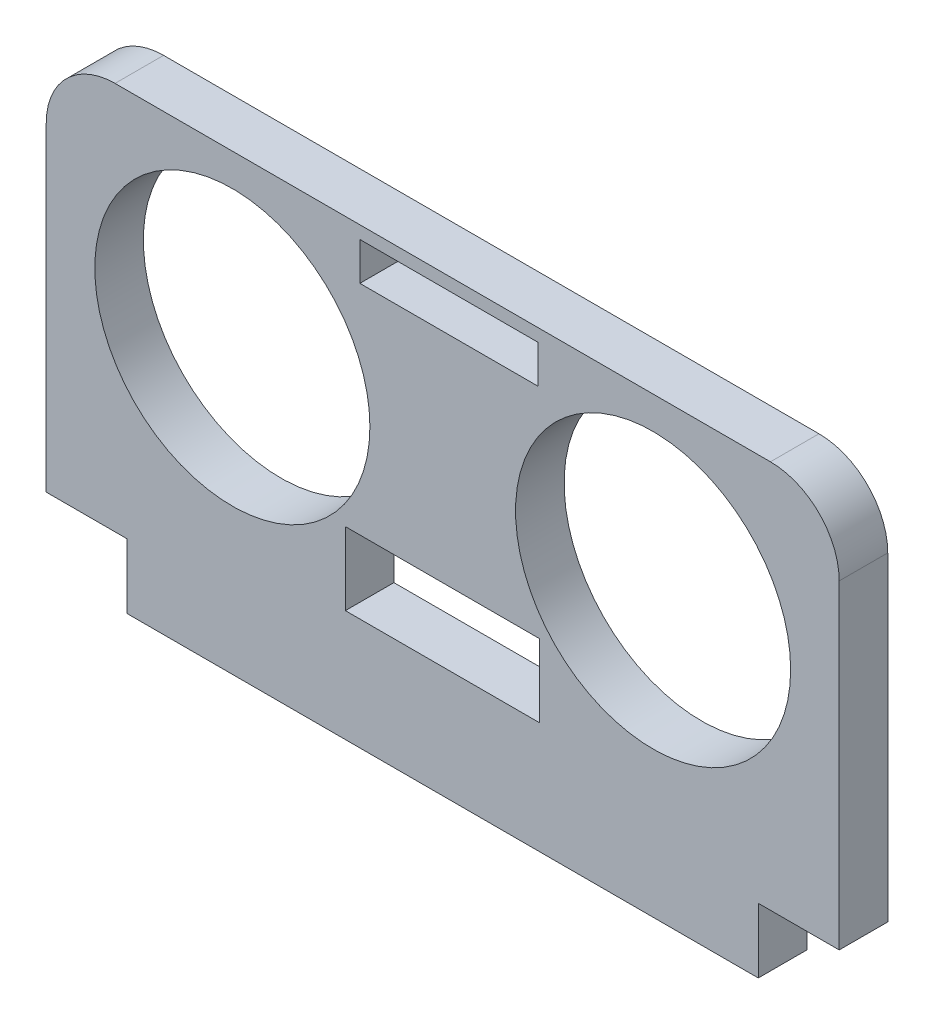
from build123d import *

# Parameters (mm, degrees)
SKETCH1_R           = 8.5
SKETCH1_W           = 12
SKETCH1_H           = 4.5
SKETCH1_W_2         = 11
SKETCH1_H_2         = 2.35
BOSS_EXTRUDE2_DEPTH = 3


with BuildPart() as part:
    # Sketch1 → Boss-Extrude2 (new body)
    with BuildSketch(Plane.XY):
        with BuildLine():
            Line((-67.723514566, 14.691706599), (-67.723514566, -5.058293401))
            Line((-67.723514566, -5.058293401), (-62.723514566, -5.058293401))
            Line((-62.723514566, -5.058293401), (-62.723514566, -9.058293401))
            Line((-62.723514566, -9.058293401), (-23.723514566, -9.058293401))
            Line((-23.723514566, -9.058293401), (-23.723514566, -5.058293401))
            Line((-23.723514566, -5.058293401), (-18.723514566, -5.058293401))
            Line((-18.723514566, -5.058293401), (-18.723514566, 14.691706599))
            ThreePointArc((-18.723514566, 14.691706599), (-19.968310746, 17.696910419), (-22.973514566, 18.941706599))
            Line((-22.973514566, 18.941706599), (-63.473514566, 18.941706599))
            ThreePointArc((-63.473514566, 18.941706599), (-66.478718386, 17.696910419), (-67.723514566, 14.691706599))
        make_face()
        with Locations((-56.223514566, 8.441706599)):
            Circle(SKETCH1_R, mode=Mode.SUBTRACT)
        with Locations((-30.223514566, 8.441706599)):
            Circle(SKETCH1_R, mode=Mode.SUBTRACT)
        with Locations((-43.240297901, 0.09191466)):
            Rectangle(SKETCH1_W, SKETCH1_H, mode=Mode.SUBTRACT)
        with Locations((-42.84448226, 16.979921864)):
            Rectangle(SKETCH1_W_2, SKETCH1_H_2, mode=Mode.SUBTRACT)
    extrude(amount=BOSS_EXTRUDE2_DEPTH)


solid = part.part
